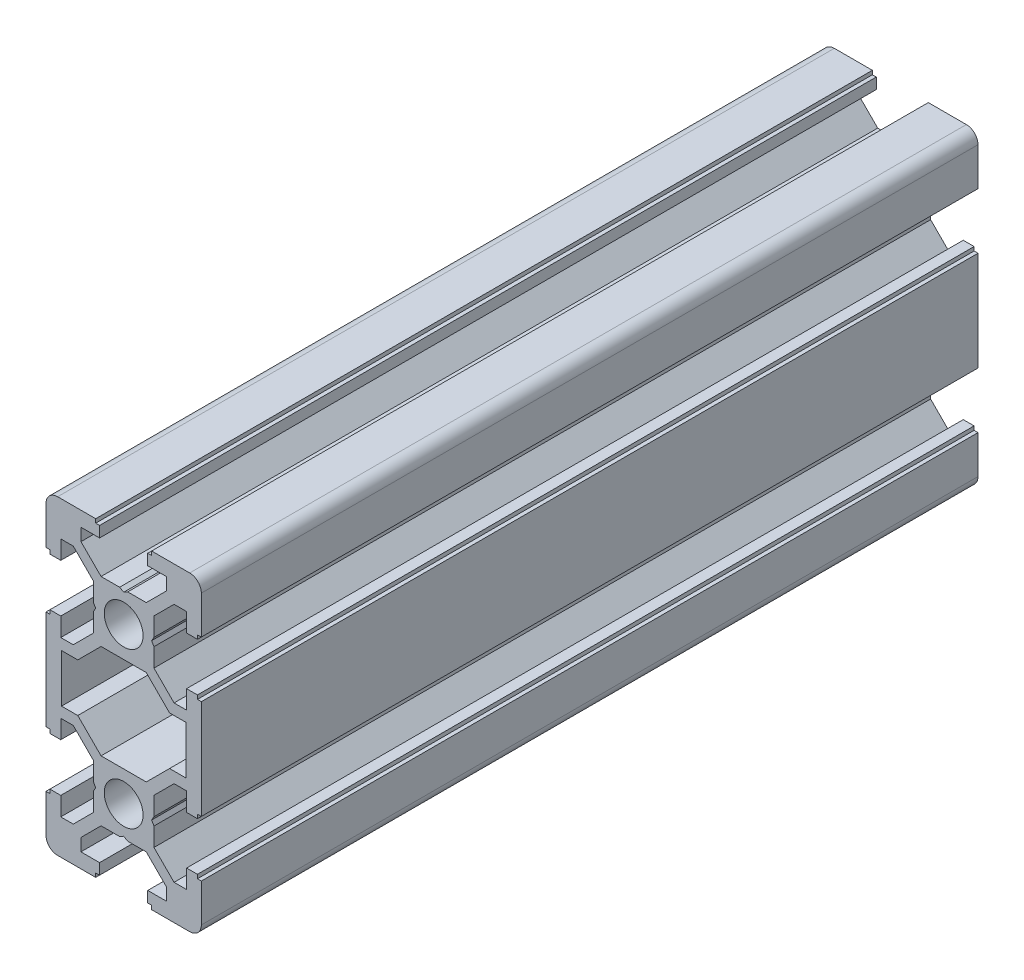
from build123d import *

# Parameters (mm, degrees)
MODEL_R         = 2.5
EXTRUDE_1_DEPTH = 100


with BuildPart() as part:
    # Model → 凸台-拉伸1 (new body)
    with BuildSketch(Plane.XY):
        with BuildLine():
            Line((-3.6, 10), (-3.9, 9.480384758))
            Line((-3.9, 9.480384758), (-3.9, 7.089949494))
            Line((-3.9, 7.089949494), (-6.489949494, 4.5))
            Line((-6.489949494, 4.5), (-8.1, 4.5))
            Line((-8.1, 4.5), (-8.1, 6.9))
            Line((-8.1, 6.9), (-9.5, 6.9))
            Line((-9.5, 6.9), (-9.5, 6.4))
            Line((-9.5, 6.4), (-10, 6.4))
            Line((-10, 6.4), (-10, -6.4))
            Line((-10, -6.4), (-9.5, -6.4))
            Line((-9.5, -6.4), (-9.5, -6.9))
            Line((-9.5, -6.9), (-8.1, -6.9))
            Line((-8.1, -6.9), (-8.1, -4.5))
            Line((-8.1, -4.5), (-6.489949494, -4.5))
            Line((-6.489949494, -4.5), (-3.9, -7.089949494))
            Line((-3.9, -7.089949494), (-3.9, -9.480384758))
            Line((-3.9, -9.480384758), (-3.6, -10))
            Line((-3.6, -10), (-3.9, -10.519615242))
            Line((-3.9, -10.519615242), (-3.9, -12.910050506))
            Line((-3.9, -12.910050506), (-6.489949494, -15.5))
            Line((-6.489949494, -15.5), (-8.1, -15.5))
            Line((-8.1, -15.5), (-8.1, -13.1))
            Line((-8.1, -13.1), (-9.5, -13.1))
            Line((-9.5, -13.1), (-9.5, -13.6))
            Line((-9.5, -13.6), (-10, -13.6))
            Line((-10, -13.6), (-10, -18.5))
            ThreePointArc((-10, -18.5), (-9.560660172, -19.560660172), (-8.5, -20))
            Line((-8.5, -20), (-3.6, -20))
            Line((-3.6, -20), (-3.6, -19.5))
            Line((-3.6, -19.5), (-3.1, -19.5))
            Line((-3.1, -19.5), (-3.1, -18.1))
            Line((-3.1, -18.1), (-5.5, -18.1))
            Line((-5.5, -18.1), (-5.5, -16.489949494))
            Line((-5.5, -16.489949494), (-2.910050506, -13.9))
            Line((-2.910050506, -13.9), (-0.519615242, -13.9))
            Line((-0.519615242, -13.9), (0, -13.6))
            Line((0, -13.6), (0.519615242, -13.9))
            Line((0.519615242, -13.9), (2.910050506, -13.9))
            Line((2.910050506, -13.9), (5.5, -16.489949494))
            Line((5.5, -16.489949494), (5.5, -18.1))
            Line((5.5, -18.1), (3.1, -18.1))
            Line((3.1, -18.1), (3.1, -19.5))
            Line((3.1, -19.5), (3.6, -19.5))
            Line((3.6, -19.5), (3.6, -20))
            Line((3.6, -20), (8.5, -20))
            ThreePointArc((8.5, -20), (9.560660172, -19.560660172), (10, -18.5))
            Line((10, -18.5), (10, -13.6))
            Line((10, -13.6), (9.5, -13.6))
            Line((9.5, -13.6), (9.5, -13.1))
            Line((9.5, -13.1), (8.1, -13.1))
            Line((8.1, -13.1), (8.1, -15.5))
            Line((8.1, -15.5), (6.489949494, -15.5))
            Line((6.489949494, -15.5), (3.9, -12.910050506))
            Line((3.9, -12.910050506), (3.9, -10.519615242))
            Line((3.9, -10.519615242), (3.6, -10))
            Line((3.6, -10), (3.9, -9.480384758))
            Line((3.9, -9.480384758), (3.9, -7.089949494))
            Line((3.9, -7.089949494), (6.489949494, -4.5))
            Line((6.489949494, -4.5), (8.1, -4.5))
            Line((8.1, -4.5), (8.1, -6.9))
            Line((8.1, -6.9), (9.5, -6.9))
            Line((9.5, -6.9), (9.5, -6.4))
            Line((9.5, -6.4), (10, -6.4))
            Line((10, -6.4), (10, 6.4))
            Line((10, 6.4), (9.5, 6.4))
            Line((9.5, 6.4), (9.5, 6.9))
            Line((9.5, 6.9), (8.1, 6.9))
            Line((8.1, 6.9), (8.1, 4.5))
            Line((8.1, 4.5), (6.489949494, 4.5))
            Line((6.489949494, 4.5), (3.9, 7.089949494))
            Line((3.9, 7.089949494), (3.9, 9.480384758))
            Line((3.9, 9.480384758), (3.6, 10))
            Line((3.6, 10), (3.9, 10.519615242))
            Line((3.9, 10.519615242), (3.9, 12.910050506))
            Line((3.9, 12.910050506), (6.489949494, 15.5))
            Line((6.489949494, 15.5), (8.1, 15.5))
            Line((8.1, 15.5), (8.1, 13.1))
            Line((8.1, 13.1), (9.5, 13.1))
            Line((9.5, 13.1), (9.5, 13.6))
            Line((9.5, 13.6), (10, 13.6))
            Line((10, 13.6), (10, 18.5))
            ThreePointArc((10, 18.5), (9.560660172, 19.560660172), (8.5, 20))
            Line((8.5, 20), (3.6, 20))
            Line((3.6, 20), (3.6, 19.5))
            Line((3.6, 19.5), (3.1, 19.5))
            Line((3.1, 19.5), (3.1, 18.1))
            Line((3.1, 18.1), (5.5, 18.1))
            Line((5.5, 18.1), (5.5, 16.489949494))
            Line((5.5, 16.489949494), (2.910050506, 13.9))
            Line((2.910050506, 13.9), (0.519615242, 13.9))
            Line((0.519615242, 13.9), (0, 13.6))
            Line((0, 13.6), (-0.519615242, 13.9))
            Line((-0.519615242, 13.9), (-2.910050506, 13.9))
            Line((-2.910050506, 13.9), (-5.5, 16.489949494))
            Line((-5.5, 16.489949494), (-5.5, 18.1))
            Line((-5.5, 18.1), (-3.1, 18.1))
            Line((-3.1, 18.1), (-3.1, 19.5))
            Line((-3.1, 19.5), (-3.6, 19.5))
            Line((-3.6, 19.5), (-3.6, 20))
            Line((-3.6, 20), (-8.5, 20))
            ThreePointArc((-8.5, 20), (-9.560660172, 19.560660172), (-10, 18.5))
            Line((-10, 18.5), (-10, 13.6))
            Line((-10, 13.6), (-9.5, 13.6))
            Line((-9.5, 13.6), (-9.5, 13.1))
            Line((-9.5, 13.1), (-8.1, 13.1))
            Line((-8.1, 13.1), (-8.1, 15.5))
            Line((-8.1, 15.5), (-6.489949494, 15.5))
            Line((-6.489949494, 15.5), (-3.9, 12.910050506))
            Line((-3.9, 12.910050506), (-3.9, 10.519615242))
            Line((-3.9, 10.519615242), (-3.6, 10))
        make_face()
        with Locations((0, 10)):
            Circle(MODEL_R, mode=Mode.SUBTRACT)
        with Locations((0, -10)):
            Circle(MODEL_R, mode=Mode.SUBTRACT)
        Polygon((8, -3.1), (5.910050506, -3.1), (2.910050506, -6.1), (-2.910050506, -6.1), (-5.910050506, -3.1), (-8, -3.1), (-8, 3.1), (-5.910050506, 3.1), (-2.910050506, 6.1), (2.910050506, 6.1), (5.910050506, 3.1), (8, 3.1), align=None, mode=Mode.SUBTRACT)
    extrude(amount=EXTRUDE_1_DEPTH)


solid = part.part
